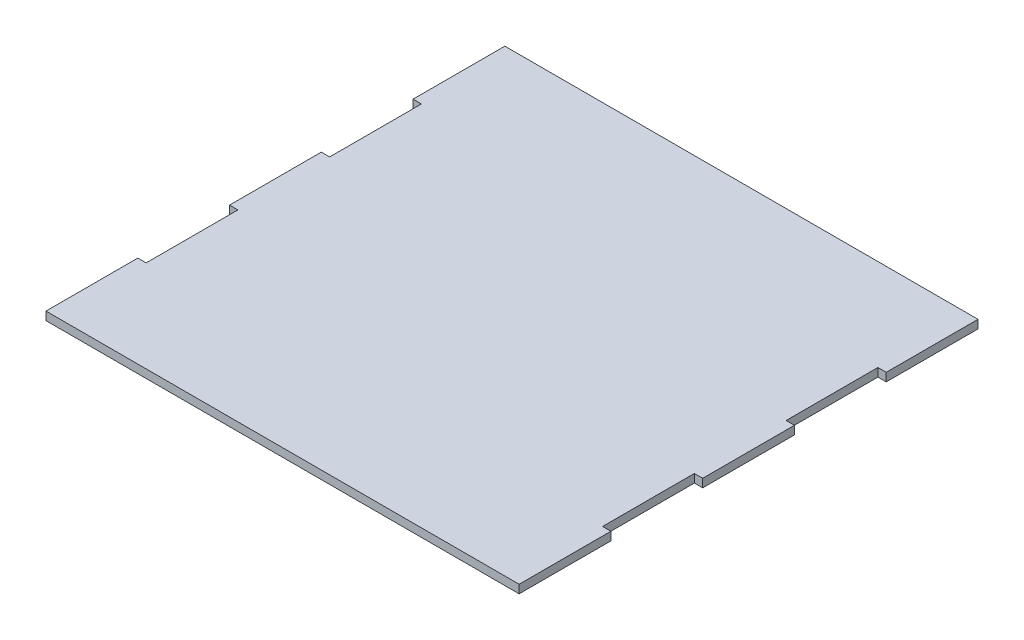
from build123d import *

# Parameters (mm, degrees)
BOSS_EXTRUDE1_DEPTH = 2.7


with BuildPart() as part:
    # Sketch1 → Boss-Extrude1 (new body)
    with BuildSketch(Plane(origin=(0, 0, 0), x_dir=(1, 0, 0), z_dir=(0, 1, 0))):
        Polygon((76.7, -74.385), (-76.7, -74.385), (-76.7, -44.631), (-74, -44.631), (-74, -14.877), (-76.7, -14.877), (-76.7, 14.877), (-74, 14.877), (-74, 44.631), (-76.7, 44.631), (-76.7, 74.385), (76.7, 74.385), (76.7, 44.631), (74, 44.631), (74, 14.877), (76.7, 14.877), (76.7, -14.877), (74, -14.877), (74, -44.631), (76.7, -44.631), align=None)
    extrude(amount=BOSS_EXTRUDE1_DEPTH)


solid = part.part
